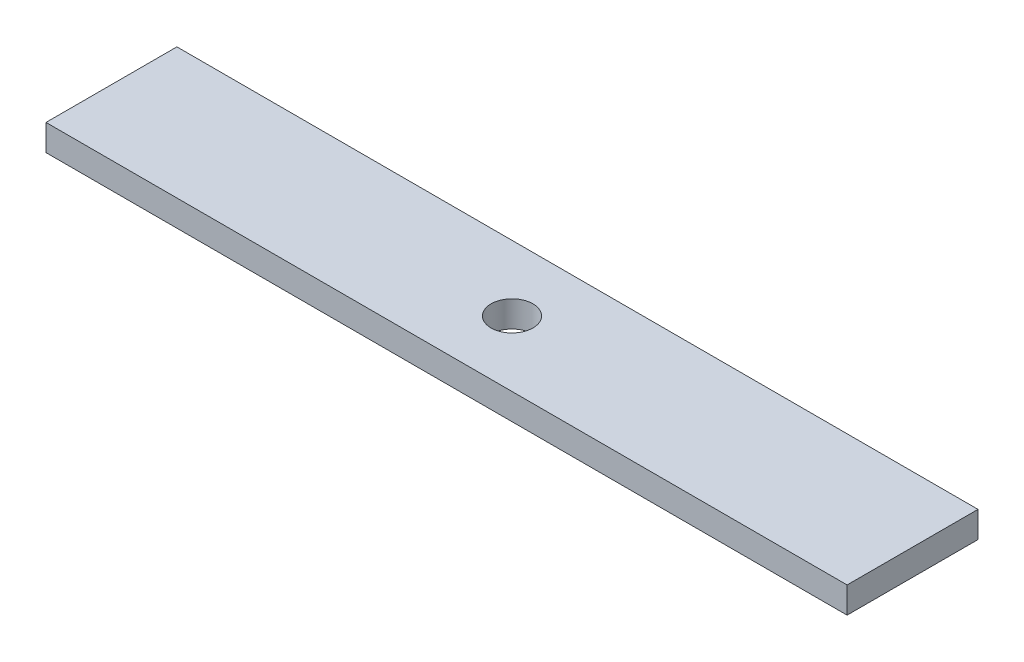
from build123d import *

# Parameters (mm, degrees)
SKETCH1_W           = 153
SKETCH1_H           = 25
SKETCH1_R           = 4
BOSS_EXTRUDE1_DEPTH = 5


with BuildPart() as part:
    # Sketch1 → Boss-Extrude1 (new body)
    with BuildSketch(Plane(origin=(0, 0, 0), x_dir=(1, 0, 0), z_dir=(0, 1, 0))):
        with Locations((0, 12.5)):
            Rectangle(SKETCH1_W, SKETCH1_H)
        with Locations(Location((0, 12.5, 0), (0, 0, 270))):
            Circle(SKETCH1_R, mode=Mode.SUBTRACT)
    extrude(amount=BOSS_EXTRUDE1_DEPTH)


solid = part.part
